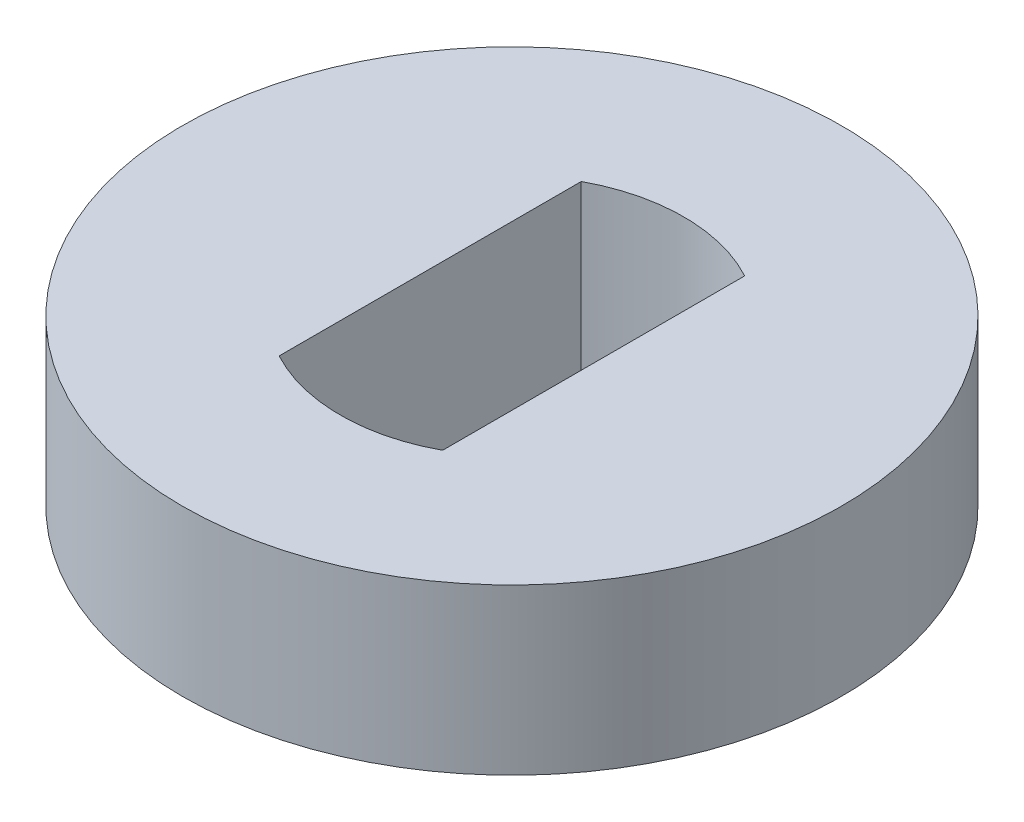
from build123d import *

# Parameters (mm, degrees)
SKETCH1_R           = 6
BOSS_EXTRUDE1_DEPTH = 3


with BuildPart() as part:
    # Sketch1 → Boss-Extrude1 (new body)
    with BuildSketch(Plane(origin=(0, 0, 0), x_dir=(1, 0, 0), z_dir=(0, 1, 0))):
        with Locations(Location((0, 0, 0), (0, 0, 270))):
            Circle(SKETCH1_R)
        with BuildLine():
            Line((-1.488152916, -2.75), (-1.488152916, 2.75))
            ThreePointArc((-1.488152916, 2.75), (0, 3.126835317), (1.488152916, 2.75))
            Line((1.488152916, 2.75), (1.488152916, -2.75))
            ThreePointArc((1.488152916, -2.75), (0, -3.126835317), (-1.488152916, -2.75))
        make_face(mode=Mode.SUBTRACT)
    extrude(amount=BOSS_EXTRUDE1_DEPTH)


solid = part.part
